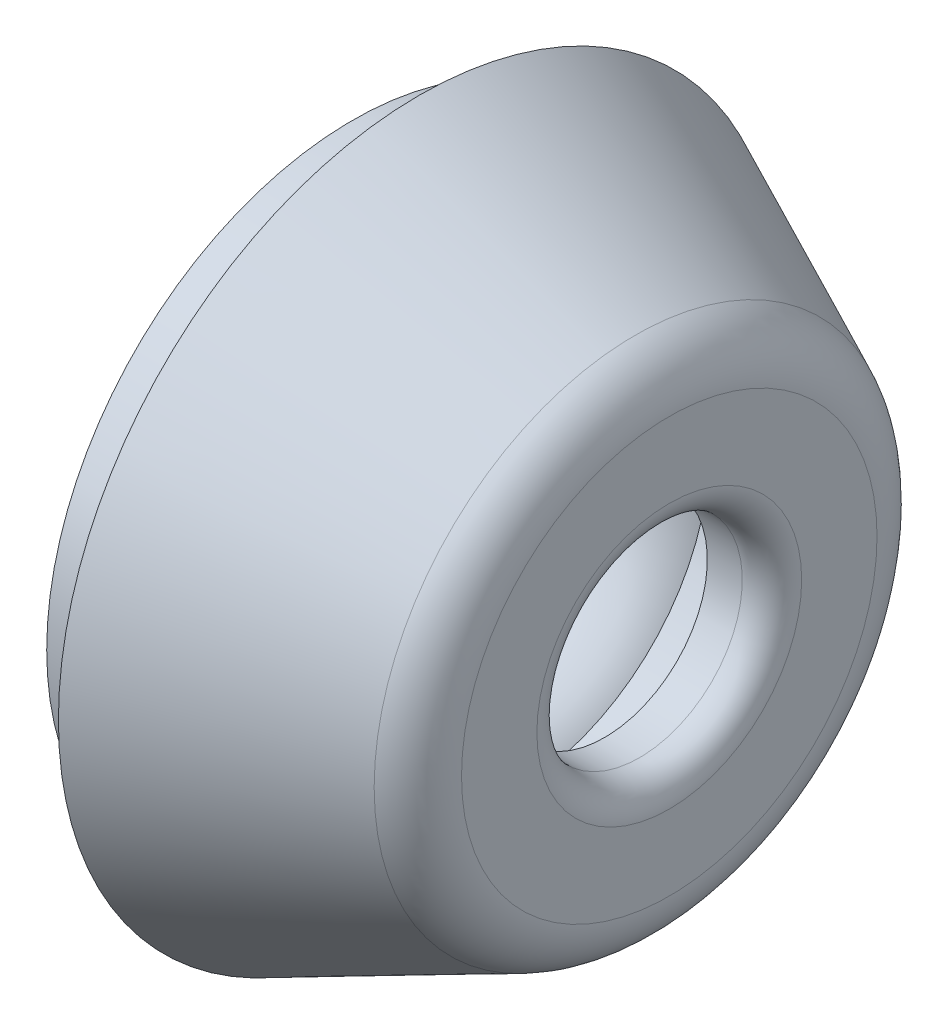
from build123d import *


with BuildPart() as part:
    # Esquisse1 → Révolution1 (revolve)
    with BuildSketch(Plane.XY, mode=Mode.PRIVATE) as r_volution1_sk:
        with BuildLine():
            Line((98.182636899, 9.898736356), (98.182636899, 15.453384419))
            Line((98.182636899, 15.453384419), (101.558174274, 15.453384419))
            Line((101.558174274, 15.453384419), (101.558174274, 18.238189454))
            Line((101.558174274, 18.238189454), (112.461882094, 13.189244146))
            ThreePointArc((112.461882094, 13.189244146), (113.715718176, 12.094110728), (114.182636899, 10.496171735))
            Line((114.182636899, 10.496171735), (114.182636899, 6.689516504))
            ThreePointArc((114.182636899, 6.689516504), (113.743297071, 5.628856332), (112.682636899, 5.189516504))
            Line((112.682636899, 5.189516504), (110.916617784, 5.189516504))
            Line((110.916617784, 5.189516504), (110.916617784, 9.398736356))
            ThreePointArc((110.916617784, 9.398736356), (110.770171174, 9.752289746), (110.416617784, 9.898736356))
            Line((110.416617784, 9.898736356), (106.29719914, 9.898736356))
            ThreePointArc((106.29719914, 9.898736356), (103.00637414, 8.348852557), (99.715549141, 9.898736356))
            Line((99.715549141, 9.898736356), (98.182636899, 9.898736356))
        make_face()
    revolve(r_volution1_sk.sketch.rotate(Axis((81.048552149, 0, 0), (1, 0, 0)), 90), axis=Axis((81.048552149, 0, 0), (1, 0, 0)))


solid = part.part
